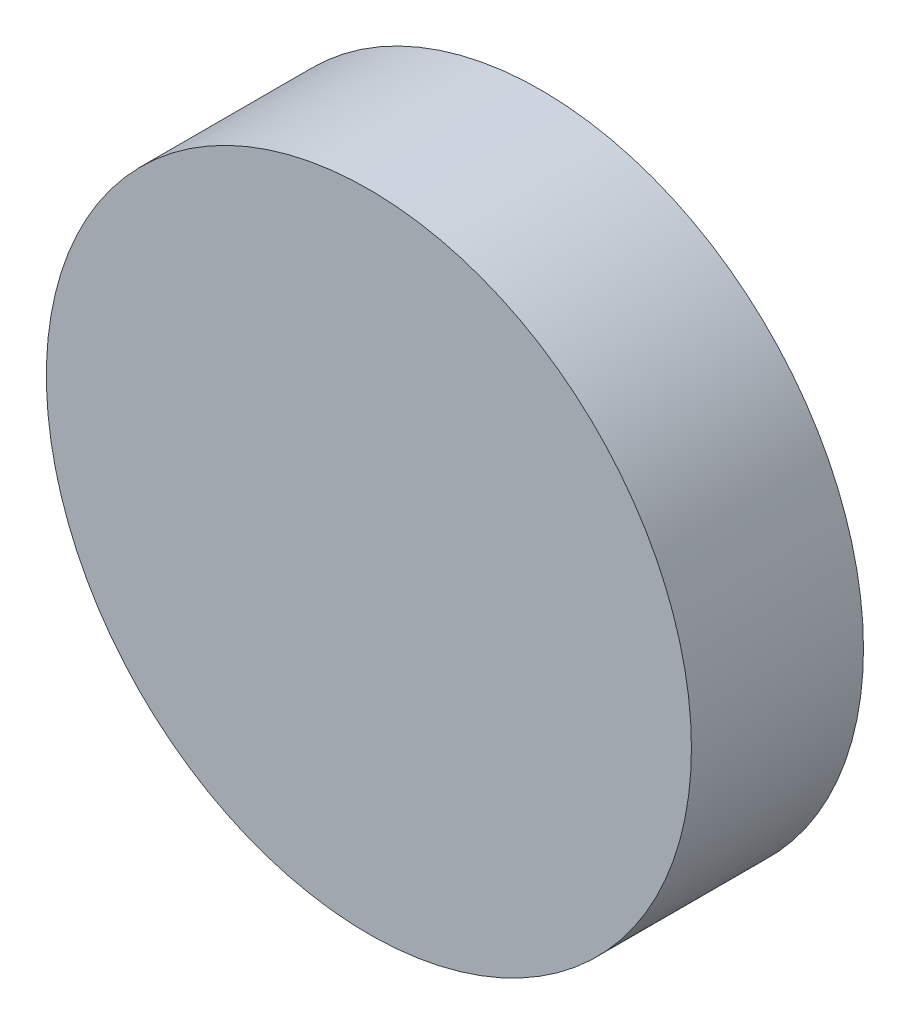
from build123d import *

# Parameters (mm, degrees)
SKETCH1_R           = 7.5
BOSS_EXTRUDE1_DEPTH = 4


with BuildPart() as part:
    # Sketch1 → Boss-Extrude1 (new body)
    with BuildSketch(Plane.XY):
        Circle(SKETCH1_R)
    extrude(amount=BOSS_EXTRUDE1_DEPTH)


solid = part.part
